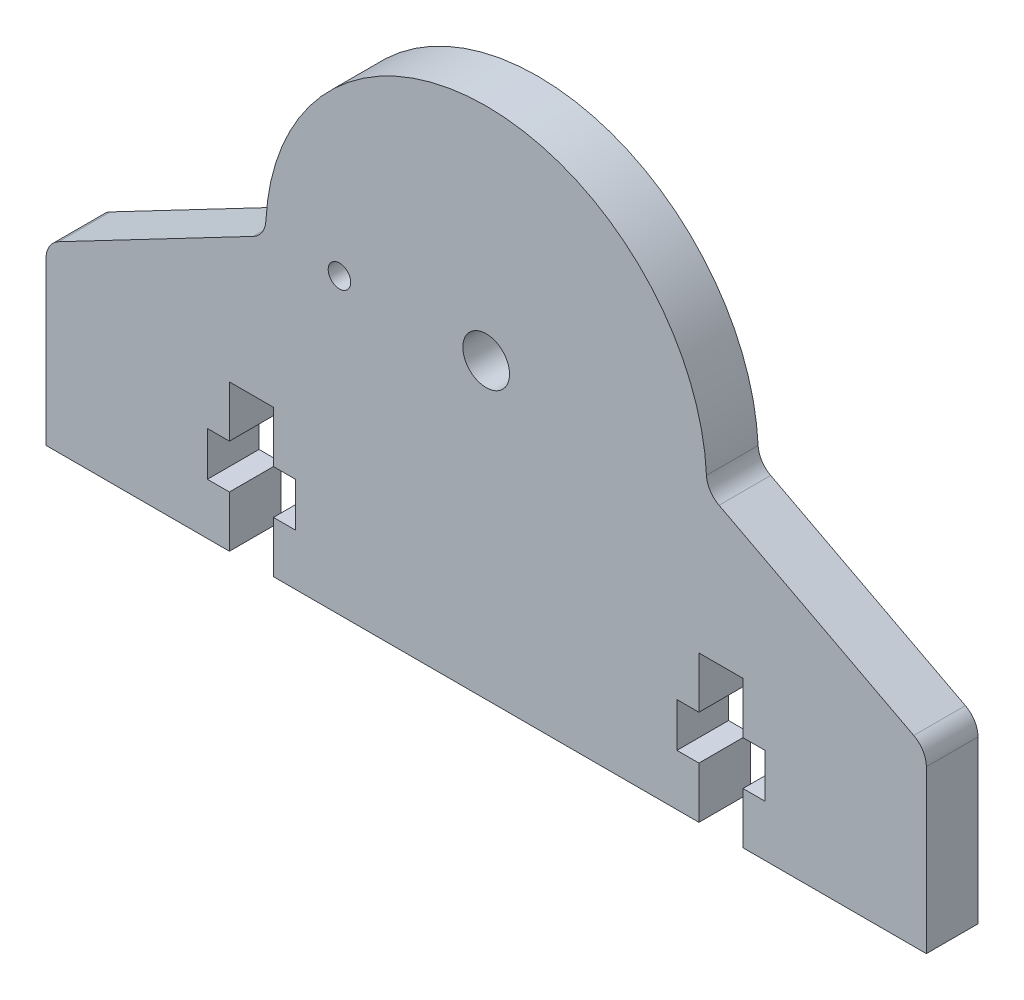
from build123d import *

# Parameters (mm, degrees)
SKETCH1_R               = 2.5273
BOSS_EXTRUDE1_DEPTH     = 2.794
F_2_CLEARANCE_HOLE1_D   = 2.4384
FILLET1_R               = 2.54
CUT_EXTRUDE2_DEPTH      = 58.306278691
CUT_EXTRUDE2_DEPTH_BACK = 58.306278691


with BuildPart() as part:
    # Sketch1 → Boss-Extrude1 (new, symmetric)
    with BuildSketch(Plane.XY):
        with BuildLine():
            Line((-23.865093494, -0.254), (-47.625, -12.7))
            Line((-47.625, -12.7), (-47.625, -31.75))
            Line((-47.625, -31.75), (47.625, -31.75))
            Line((47.625, -31.75), (47.625, -12.7))
            Line((47.625, -12.7), (23.865093494, -0.254))
            Line((23.865093494, -0.254), (23.865093494, 0))
            ThreePointArc((23.865093494, 0), (0, 23.865093494), (-23.865093494, 0))
            Line((-23.865093494, 0), (-23.865093494, -0.254))
        make_face()
        Circle(SKETCH1_R, mode=Mode.SUBTRACT)
    extrude(amount=BOSS_EXTRUDE1_DEPTH, both=True)

    # #2 Clearance Hole1 (through all)
    with Locations(Plane.XY.offset(2.794)):
        with Locations((-15.875, 0)):
            Hole(F_2_CLEARANCE_HOLE1_D / 2)

    # Fillet1
    fillet1_edges = [part.edges().sort_by_distance(p)[0] for p in [
        (47.625, -12.7, 0),
        (23.865093494, -0.254, 0),
        (-47.625, -12.7, 0),
        (-23.865093494, -0.254, 0),
    ]]
    fillet(fillet1_edges, radius=FILLET1_R)

    # Sketch6 → Cut-Extrude2 (cut, two sides: drawn at the far end of the back side and taken through both)
    with BuildSketch(Plane.XY.offset(-CUT_EXTRUDE2_DEPTH_BACK)):
        Polygon((-27.78125, -31.75), (-27.78125, -26.19375), (-30.1625, -26.19375), (-30.1625, -21.43125), (-27.78125, -21.43125), (-27.78125, -15.875), (-23.01875, -15.875), (-23.01875, -21.43125), (-20.6375, -21.43125), (-20.6375, -26.19375), (-23.01875, -26.19375), (-23.01875, -31.75), align=None)
        Polygon((23.01875, -31.75), (23.01875, -26.19375), (20.6375, -26.19375), (20.6375, -21.43125), (23.01875, -21.43125), (23.01875, -15.875), (27.78125, -15.875), (27.78125, -21.43125), (30.1625, -21.43125), (30.1625, -26.19375), (27.78125, -26.19375), (27.78125, -31.75), align=None)
    extrude(amount=CUT_EXTRUDE2_DEPTH + CUT_EXTRUDE2_DEPTH_BACK, mode=Mode.SUBTRACT)


solid = part.part
